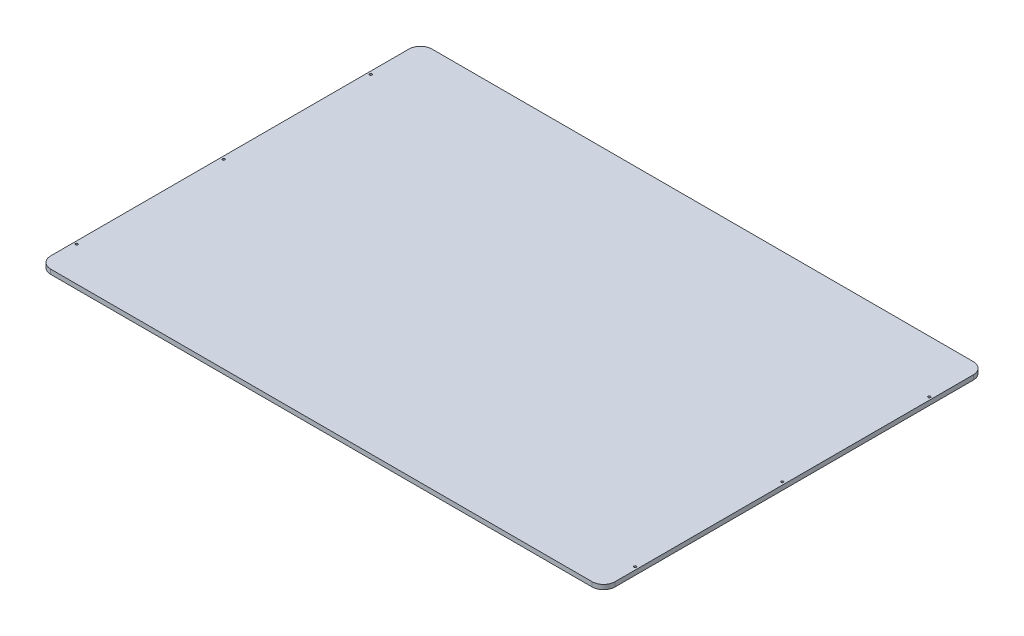
from build123d import *

# Parameters (mm, degrees)
SKETCH1_W           = 490
SKETCH1_H           = 331
BOSS_EXTRUDE1_DEPTH = 4
FILLET1_R           = 10
LPATTERN2_COUNT     = 3
LPATTERN2_PITCH     = 127.67


with BuildPart() as part:
    # Sketch1 → Boss-Extrude1 (new body)
    with BuildSketch(Plane(origin=(0, 0, 0), x_dir=(1, 0, 0), z_dir=(0, 1, 0))):
        Rectangle(SKETCH1_W, SKETCH1_H)
    extrude(amount=BOSS_EXTRUDE1_DEPTH)

    # Fillet1
    fillet1_edges = [part.edges().sort_by_distance(p)[0] for p in [
        (-245, 2, -165.5),
        (245, 2, -165.5),
        (245, 2, 165.5),
        (-245, 2, 165.5),
    ]]
    fillet(fillet1_edges, radius=FILLET1_R)

    # Sketch4 → Tap Drill for M2.5x0.45 Tap1 (revolve, cut)
    with BuildSketch(Plane(origin=(-242.5, 0, 135.5), x_dir=(0, 0, -1), z_dir=(1, 0, 0))):
        Polygon((0, 0), (0, 5.615882135), (1.025, 5), (1.025, 0), align=None)
    tap_drill_for_m2_5x0_45_tap1 = revolve(axis=Axis((-242.5, -6.35, 135.5), (0, 1, 0)), mode=Mode.SUBTRACT)

    # LPattern2: Tap Drill for M2.5x0.45 Tap1 ×3
    with Locations(*[(0, 0, -i * LPATTERN2_PITCH) for i in range(1, LPATTERN2_COUNT)]):
        add(tap_drill_for_m2_5x0_45_tap1, mode=Mode.SUBTRACT)

    # Mirror2: Tap Drill for M2.5x0.45 Tap1 across plane
    add(tap_drill_for_m2_5x0_45_tap1.mirror(Plane(origin=(0, 0, 0), x_dir=(0, 0, 1), z_dir=(1, 0, 0))), mode=Mode.SUBTRACT)

    # Mirror2 copy 1 sketch → Mirror2 copy 1 (revolve, cut)
    with BuildSketch(Plane(origin=(242.5, 0, 7.83), x_dir=(0, 0, -1), z_dir=(-1, 0, 0))):
        Polygon((0, 0), (0, -5.615882135), (1.025, -5), (1.025, 0), align=None)
    revolve(axis=Axis((242.5, -6.35, 7.83), (0, -1, 0)), mode=Mode.SUBTRACT)

    # Mirror2 copy 2 sketch → Mirror2 copy 2 (revolve, cut)
    with BuildSketch(Plane(origin=(242.5, 0, -119.84), x_dir=(0, 0, -1), z_dir=(-1, 0, 0))):
        Polygon((0, 0), (0, -5.615882135), (1.025, -5), (1.025, 0), align=None)
    revolve(axis=Axis((242.5, -6.35, -119.84), (0, -1, 0)), mode=Mode.SUBTRACT)


solid = part.part
